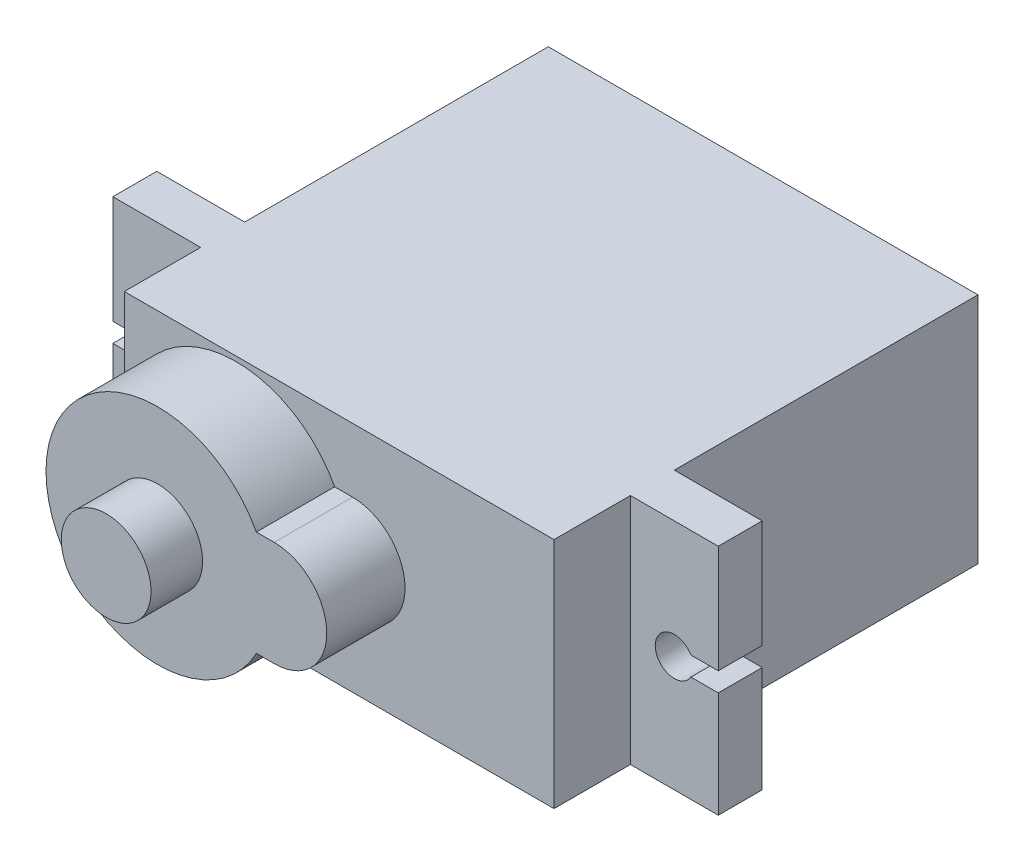
from build123d import *

# Parameters (mm, degrees)
SZKIC1_W                         = 22.5
SZKIC1_H                         = 12.2
DODANIE_WYCI_GNI_CIE1_DEPTH      = 22.2
DODANIE_WYCI_GNI_CIE2_DEPTH      = 4.6
DODANIE_WYCI_GNI_CIE2_DEPTH_BACK = 27.1
SZKIC2_W                         = 2.3
SZKIC2_H                         = 12.2
DODANIE_WYCI_GNI_CIE3_DEPTH      = 4.1
SZKIC8_R                         = 2.35
DODANIE_WYCI_GNI_CIE4_DEPTH      = 2.7
WYTNIJ_WYCI_GNI_CIE2_DEPTH       = 2.3
SZKIC11_R                        = 0.75
DODANIE_WYCI_GNI_CIE8_DEPTH      = 25.5


with BuildPart() as part:
    # Szkic1 → Dodanie-wyciągnięcie1 (new body)
    with BuildSketch(Plane.XY):
        with Locations((-11.470890411, -6.375490196)):
            Rectangle(SZKIC1_W, SZKIC1_H)
    extrude(amount=DODANIE_WYCI_GNI_CIE1_DEPTH)

    # Szkic2 → Dodanie-wyciągnięcie2 (add, two sides: drawn at the far end of the back side and taken through both)
    with BuildSketch(Plane(origin=(-0.220890411, 0, 0), x_dir=(0, 0, -1), z_dir=(1, 0, 0)).offset(-DODANIE_WYCI_GNI_CIE2_DEPTH_BACK)):
        with Locations((-17.05, -6.375490196)):
            Rectangle(SZKIC2_W, SZKIC2_H)
    extrude(amount=DODANIE_WYCI_GNI_CIE2_DEPTH + DODANIE_WYCI_GNI_CIE2_DEPTH_BACK)

    # Szkic3 → Dodanie-wyciągnięcie3 (add)
    with BuildSketch(Plane.XY.offset(22.2)):
        with BuildLine():
            Line((-10.770890411, -9.125490196), (-11.707558154, -9.125490196))
            ThreePointArc((-11.707558154, -9.125490196), (-22.720890411, -6.375490196), (-11.707558154, -3.625490196))
            Line((-11.707558154, -3.625490196), (-10.770890411, -3.625490196))
            ThreePointArc((-10.770890411, -3.625490196), (-8.020890411, -6.375490196), (-10.770890411, -9.125490196))
        make_face()
    extrude(amount=DODANIE_WYCI_GNI_CIE3_DEPTH)

    # Szkic8 → Dodanie-wyciągnięcie4 (add)
    with BuildSketch(Plane.XY.offset(26.3)):
        with Locations(Location((-16.870890411, -6.375490196, 0), (0, 0, 180))):
            Circle(SZKIC8_R)
    extrude(amount=DODANIE_WYCI_GNI_CIE4_DEPTH)

    # Szkic10 → Wytnij-wyciągnięcie2 (cut)
    with BuildSketch(Plane.XY.offset(18.2)):
        with BuildLine():
            Line((-27.320890411, -5.925490196), (-27.320890411, -6.925490196))
            Line((-27.320890411, -6.925490196), (-25.886915815, -6.925490196))
            ThreePointArc((-25.886915815, -6.925490196), (-24.020890411, -6.425490196), (-25.886915815, -5.925490196))
            Line((-25.886915815, -5.925490196), (-27.320890411, -5.925490196))
        make_face()
        with BuildLine():
            Line((4.379109589, -6.925490196), (2.945134993, -6.925490196))
            ThreePointArc((2.945134993, -6.925490196), (1.079109589, -6.425490196), (2.945134993, -5.925490196))
            Line((2.945134993, -5.925490196), (4.379109589, -5.925490196))
            Line((4.379109589, -5.925490196), (4.379109589, -6.925490196))
        make_face()
    extrude(amount=-WYTNIJ_WYCI_GNI_CIE2_DEPTH, mode=Mode.SUBTRACT)

    # Szkic11 → Dodanie-wyciągnięcie8 (add)
    with BuildSketch(Plane(origin=(-0.220890411, 0, 0), x_dir=(0, 0, -1), z_dir=(1, 0, 0))):
        with Locations((-4.45, -6.375490196)):
            Circle(SZKIC11_R)
        with Locations((-4.45, -4.825490196)):
            Circle(SZKIC11_R)
        with Locations((-4.45, -7.925490196)):
            Circle(SZKIC11_R)
    extrude(amount=-DODANIE_WYCI_GNI_CIE8_DEPTH)


solid = part.part
